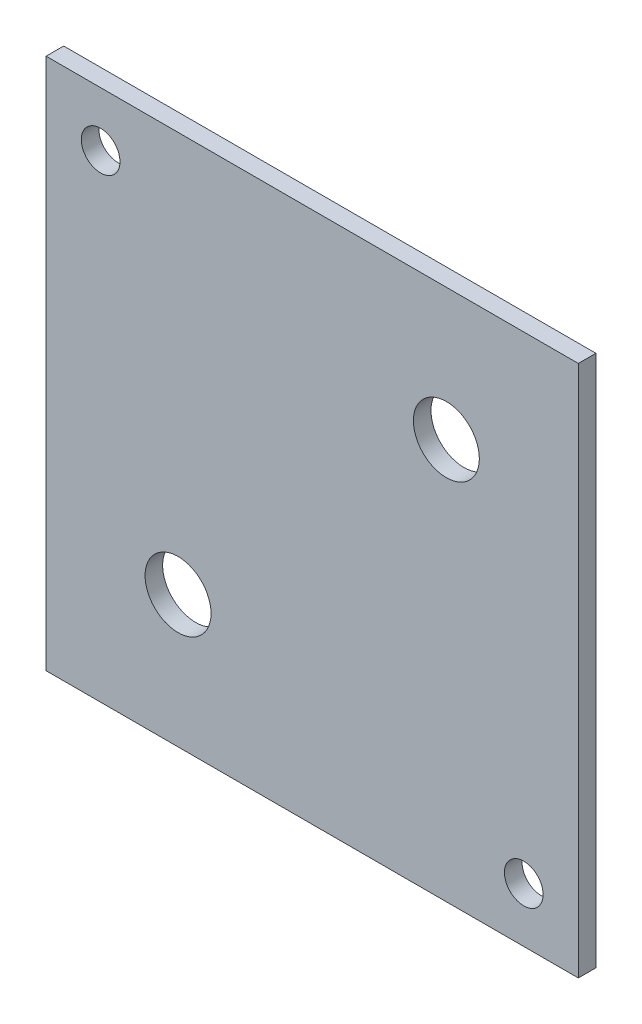
from build123d import *

# Parameters (mm, degrees)
SKETCH1_W           = 30.25
SKETCH1_H           = 30.25
SKETCH1_R           = 1.875
BOSS_EXTRUDE1_DEPTH = 1
SKETCH3_R           = 1.1
CUT_EXTRUDE1_DEPTH  = 1


with BuildPart() as part:
    # Sketch1 → Boss-Extrude1 (new body)
    with BuildSketch(Plane.XY):
        Rectangle(SKETCH1_W, SKETCH1_H)
        with Locations((-7.625, -7.625)):
            Circle(SKETCH1_R, mode=Mode.SUBTRACT)
        with Locations((7.625, 7.625)):
            Circle(SKETCH1_R, mode=Mode.SUBTRACT)
    extrude(amount=BOSS_EXTRUDE1_DEPTH)

    # Sketch3 → Cut-Extrude1 (cut)
    with BuildSketch(Plane(origin=(0, 0, 0), x_dir=(-1, 0, 0), z_dir=(0, 0, -1))):
        with Locations((12.025, 12.025)):
            Circle(SKETCH3_R)
        with Locations((-12.025, -12.025)):
            Circle(SKETCH3_R)
    extrude(amount=-CUT_EXTRUDE1_DEPTH, mode=Mode.SUBTRACT)


solid = part.part
